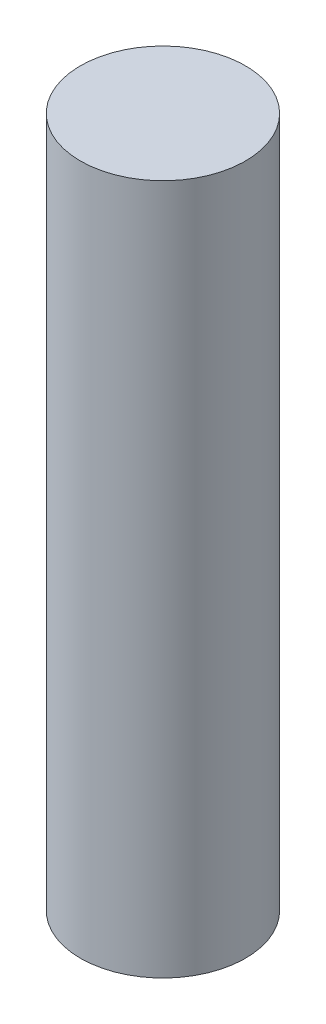
from build123d import *

# Parameters (mm, degrees)
SKETCH1_R           = 30
BOSS_EXTRUDE1_DEPTH = 251


with BuildPart() as part:
    # Sketch1 → Boss-Extrude1 (new body)
    with BuildSketch(Plane(origin=(0, 0, 0), x_dir=(1, 0, 0), z_dir=(0, 1, 0))):
        with Locations(Location((0, 0, 0), (0, 0, 270))):
            Circle(SKETCH1_R)
    extrude(amount=BOSS_EXTRUDE1_DEPTH)


solid = part.part
